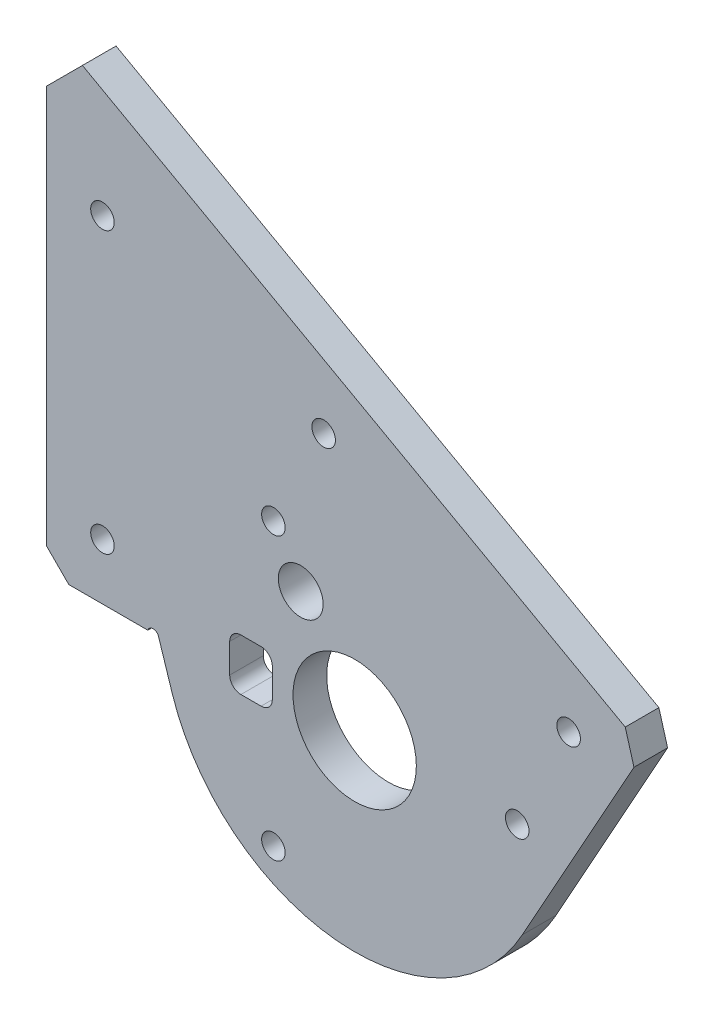
from build123d import *

# Parameters (mm, degrees)
SKETCH_1_R          = 2.1
SKETCH_1_R_2        = 4
SKETCH_1_R_3        = 11
EXTRUDE_1_DEPTH     = 3
SKETCH_3_R          = 1
SKETCH_3_R_2        = 2.1
CUT_EXTRUDE_1_DEPTH = 99.947101842
CHAMFER_2_SIZE      = 4
CHAMFER_3_SIZE      = 10
CHAMFER_3_SIZE2     = 7.354021529
SKETCH_4_W          = 7.6
SKETCH_4_H          = 9.2
CUT_EXTRUDE_2_DEPTH = 97.00692173
FILLET_1_R          = 2
SKETCH_5_R          = 2.1
CUT_EXTRUDE_3_DEPTH = 97.00692173
CHAMFER_1_SIZE      = 2


with BuildPart() as part:
    # 草图1 → 凸台-拉伸1 (new, symmetric)
    with BuildSketch(Plane.XY):
        with BuildLine():
            Line((-55, 82.03370626), (-55, -2.96629374))
            Line((-55, -2.96629374), (-35, -2.96629374))
            Line((-35, -2.96629374), (-32.567908633, -10.505776978))
            ThreePointArc((-32.567908633, -10.505776978), (-3.332171442, -34.057842799), (29.91406589, -16.618925494))
            Line((29.91406589, -16.618925494), (51.767997793, 22.718151931))
            Line((51.767997793, 22.718151931), (-55, 82.03370626))
        make_face()
        with Locations((29, 0)):
            Circle(SKETCH_1_R, mode=Mode.SUBTRACT)
        with Locations((-14.5, -25.11473671)):
            Circle(SKETCH_1_R, mode=Mode.SUBTRACT)
        with Locations((-14.5, 25.11473671)):
            Circle(SKETCH_1_R, mode=Mode.SUBTRACT)
        with Locations((-9.625, 16.670989023)):
            Circle(SKETCH_1_R_2, mode=Mode.SUBTRACT)
        Circle(SKETCH_1_R_3, mode=Mode.SUBTRACT)
    extrude(amount=EXTRUDE_1_DEPTH, both=True)

    # 草图3 → 切除-拉伸1 (cut, through all)
    with BuildSketch(Plane.XY.offset(3)):
        with Locations((-35.951708618, -3.273296519)):
            Circle(SKETCH_3_R)
        with Locations((-45, 7.03370626)):
            Circle(SKETCH_3_R_2)
        with Locations((-45, 57.03370626)):
            Circle(SKETCH_3_R_2)
    extrude(amount=-CUT_EXTRUDE_1_DEPTH, mode=Mode.SUBTRACT)

    # 倒角2
    chamfer_2_edges = [part.edges().sort_by_distance(p)[0] for p in [
        (51.767997793, 22.718151931, 0),
        (-55, -2.96629374, 0),
    ]]
    chamfer(chamfer_2_edges, length=CHAMFER_2_SIZE)

    # 倒角3
    chamfer_3_edges = [part.edges().sort_by_distance(p)[0] for p in [
        (-55, 82.03370626, 0),
    ]]
    chamfer_3_side = [part.faces().sort_by_distance(p)[0] for p in [
        (-55, 41.53370626, 0),
    ]]
    chamfer(chamfer_3_edges, length=CHAMFER_3_SIZE, length2=CHAMFER_3_SIZE2, reference=chamfer_3_side[0])

    # 草图4 → 切除-拉伸2 (cut, through all)
    with BuildSketch(Plane.XY.offset(3)):
        with Locations((-18.5, 0)):
            Rectangle(SKETCH_4_W, SKETCH_4_H)
    extrude(amount=-CUT_EXTRUDE_2_DEPTH, mode=Mode.SUBTRACT)

    # 圆角1
    fillet_1_edges = [part.edges().sort_by_distance(p)[0] for p in [
        (-14.7, 4.6, 0),
        (-14.7, -4.6, 0),
        (-22.3, -4.6, 0),
        (-22.3, 4.6, 0),
    ]]
    fillet(fillet_1_edges, radius=FILLET_1_R)

    # 草图5 → 切除-拉伸3 (cut, through all)
    with BuildSketch(Plane.XY.offset(3)):
        with Locations((-5.537868087, 43.115155041)):
            Circle(SKETCH_5_R)
        with Locations((38.16999572, 18.833008482)):
            Circle(SKETCH_5_R)
    extrude(amount=-CUT_EXTRUDE_3_DEPTH, mode=Mode.SUBTRACT)

    # 倒角1
    chamfer_1_edges = [part.edges().sort_by_distance(p)[0] for p in [
        (-7.637868087, 43.115155041, -3),
        (36.06999572, 18.833008482, -3),
        (-47.1, 7.03370626, -3),
        (-47.1, 57.03370626, -3),
    ]]
    chamfer(chamfer_1_edges, length=CHAMFER_1_SIZE)


solid = part.part
